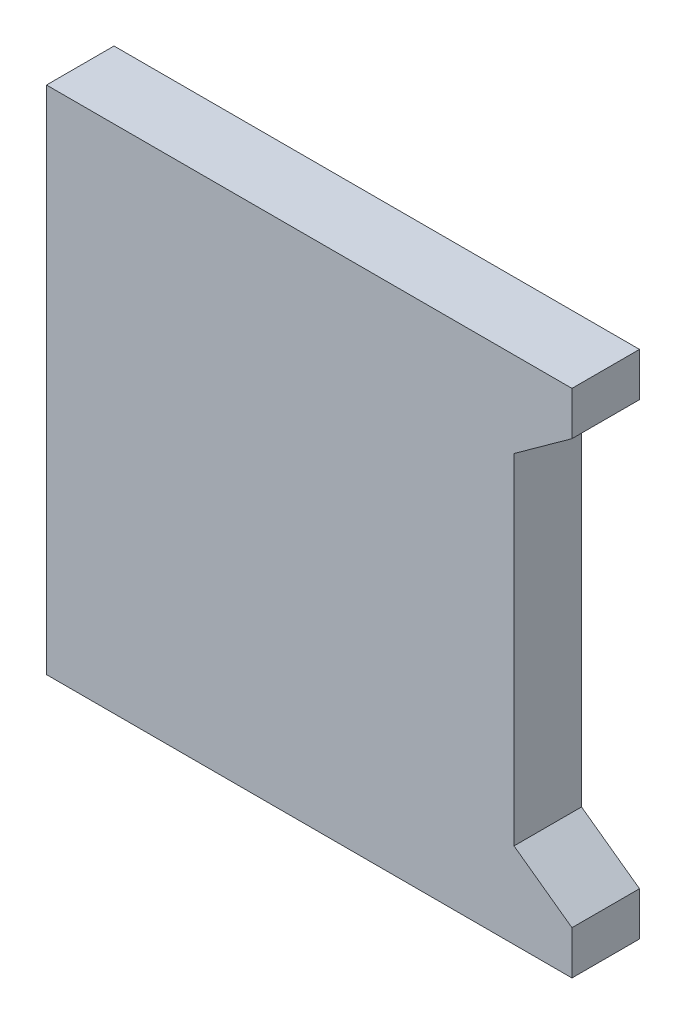
from build123d import *

# Parameters (mm, degrees)
BOSS_EXTRUDE1_DEPTH = 1.55


with BuildPart() as part:
    # Sketch1 → Boss-Extrude1 (new body)
    with BuildSketch(Plane.XY):
        Polygon((10.73, 9.76), (12.06, 10.72), (12.06, 11.72), (0, 11.72), (0, 0), (12.06, 0), (12.06, 1), (10.73, 1.96), align=None)
    extrude(amount=BOSS_EXTRUDE1_DEPTH)


solid = part.part
